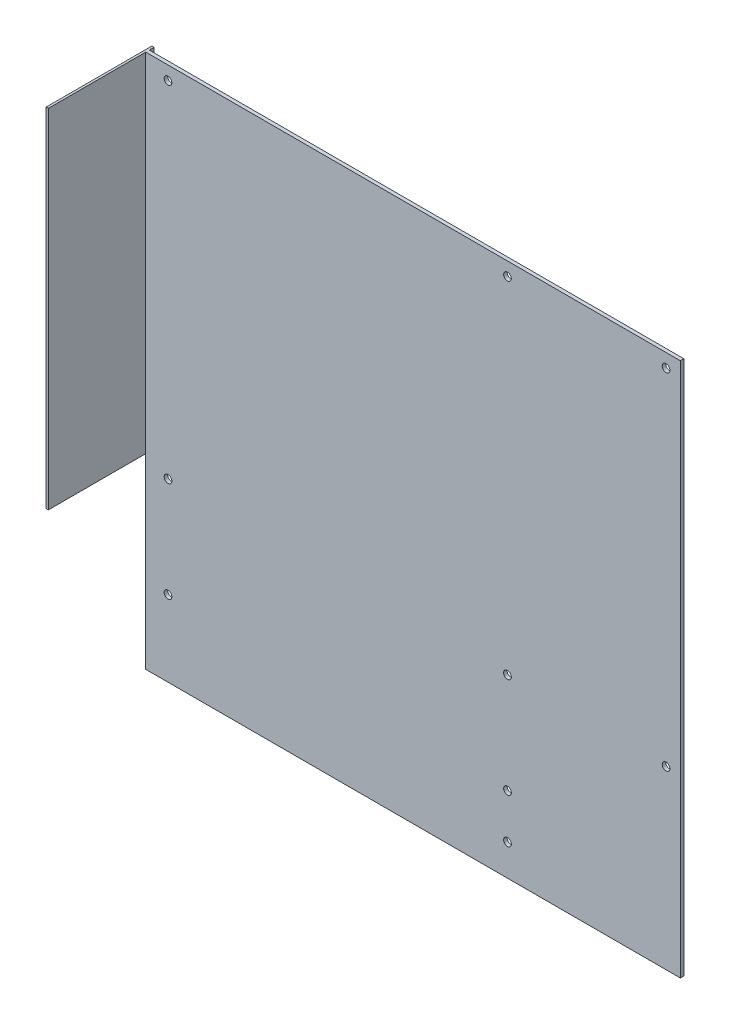
from build123d import *

# Parameters (mm, degrees)
SKETCH_1_W           = 244
SKETCH_1_H           = 244
EXTRUDE_1_DEPTH      = 1.6
SKETCH_2_R           = 1.75
CUT_EXTRUDE_1_DEPTH  = 346.071818612
EXTRUDE_2_DEPTH      = 44.45
EXTRUDE_2_DEPTH_BACK = 3.81
SKETCH_3_W           = 1
SKETCH_3_H           = 158.75


with BuildPart() as part:
    # 草图1 → 凸台-拉伸1 (new body)
    with BuildSketch(Plane.XY):
        with Locations((122, 122)):
            Rectangle(SKETCH_1_W, SKETCH_1_H)
    extrude(amount=EXTRUDE_1_DEPTH)

    # 草图2 → 切除-拉伸1 (cut, through all)
    with BuildSketch(Plane.XY.offset(1.6)):
        with Locations((10.16, 34.63)):
            Circle(SKETCH_2_R)
        with Locations((10.16, 80.35)):
            Circle(SKETCH_2_R)
        with Locations((165.1, 34.63)):
            Circle(SKETCH_2_R)
        with Locations((165.1, 80.35)):
            Circle(SKETCH_2_R)
        with Locations((165.1, 14.31)):
            Circle(SKETCH_2_R)
        with Locations((237.49, 80.35)):
            Circle(SKETCH_2_R)
        with Locations((10.16, 237.83)):
            Circle(SKETCH_2_R)
        with Locations((165.1, 237.83)):
            Circle(SKETCH_2_R)
        with Locations((237.49, 237.83)):
            Circle(SKETCH_2_R)
    extrude(amount=-CUT_EXTRUDE_1_DEPTH, mode=Mode.SUBTRACT)

    # 草图3 → 凸台-拉伸2 (add, two sides: drawn at the far end of the back side and taken through both)
    with BuildSketch(Plane.XY.offset(1.6).offset(-EXTRUDE_2_DEPTH_BACK)):
        with Locations((-0.5, 164.625)):
            Rectangle(SKETCH_3_W, SKETCH_3_H)
    extrude(amount=EXTRUDE_2_DEPTH + EXTRUDE_2_DEPTH_BACK)


solid = part.part
